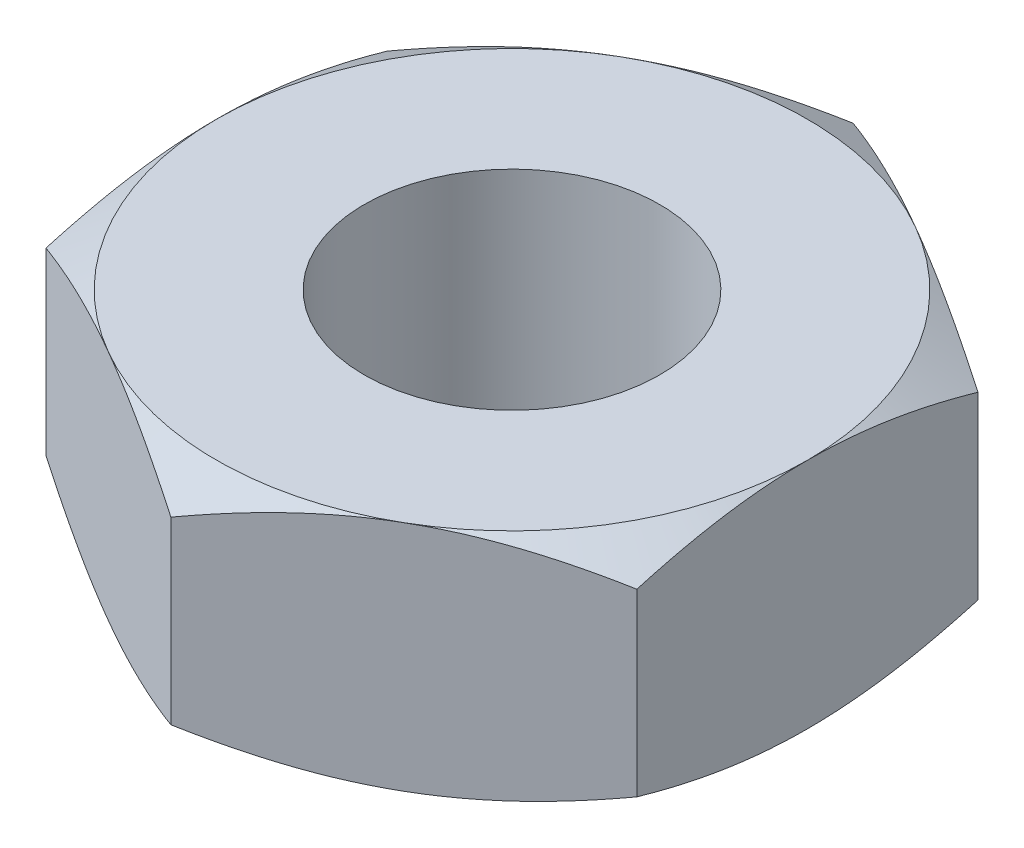
from build123d import *

# Parameters (mm, degrees)
BOSS_EXTRUDE2_DEPTH     = 5
SKETCH6_R               = 6.35
CUT_EXTRUDE3_DEPTH      = 22.82529114
SKETCH7_OUTSIDE_W       = 114.482
SKETCH7_OUTSIDE_H       = 118.412
SKETCH7_OUTSIDE_R       = 12.7
CUT_EXTRUDE4_DEPTH      = 22.82529114
CUT_EXTRUDE4_DRAFT      = -60
MIRROR3_COPY_1_SKETCH_W = 114.482
MIRROR3_COPY_1_SKETCH_H = 118.412
MIRROR3_COPY_1_SKETCH_R = 12.7
MIRROR3_COPY_1_DEPTH    = 22.82529114
MIRROR3_COPY_1_DRAFT    = -60


with BuildPart() as part:
    # Sketch2 → Boss-Extrude2 (new, symmetric)
    with BuildSketch(Plane(origin=(0, 0, 0), x_dir=(1, 0, 0), z_dir=(0, 1, 0))):
        Polygon((0, -14.664696837), (12.7, -7.332348419), (12.7, 7.332348419), (0, 14.664696837), (-12.7, 7.332348419), (-12.7, -7.332348419), align=None)
    extrude(amount=BOSS_EXTRUDE2_DEPTH, both=True)

    # Sketch6 → Cut-Extrude3 (cut, through all)
    with BuildSketch(Plane(origin=(0, 5, 0), x_dir=(1, 0, 0), z_dir=(0, 1, 0))):
        with Locations(Location((0, 0, 0), (0, 0, 270))):
            Circle(SKETCH6_R)
    extrude(amount=-CUT_EXTRUDE3_DEPTH, mode=Mode.SUBTRACT)


with BuildPart() as cut_extrude4_tool:
    # Sketch7 outside → Cut-Extrude4 (with draft: the straight prism first)
    with BuildSketch(Plane(origin=(0, 5, 0), x_dir=(1, 0, 0), z_dir=(0, 1, 0))):
        Rectangle(SKETCH7_OUTSIDE_W, SKETCH7_OUTSIDE_H)
        Circle(SKETCH7_OUTSIDE_R, mode=Mode.SUBTRACT)
    extrude(amount=-CUT_EXTRUDE4_DEPTH)
    # Cut-Extrude4: the draft: its side faces are tilted about the plane it starts from
    cut_extrude4_sides = [cut_extrude4_tool.faces().sort_by_distance(p)[0] for p in [
        (0, -6.41264557, 59.206),
        (57.241, -6.41264557, 0),
        (0, -6.41264557, -59.206),
        (-57.241, -6.41264557, 0),
        (-12.7, -6.41264557, 0),
    ]]
    draft(cut_extrude4_sides, Plane(origin=(0, 5, 0), x_dir=(1, 0, 0), z_dir=(0, 1, 0)), CUT_EXTRUDE4_DRAFT)


with BuildPart() as part_1:
    add(part.part)

    # Cut-Extrude4: cut by cut_extrude4_tool
    add(cut_extrude4_tool.part, mode=Mode.SUBTRACT)


with BuildPart() as mirror3_copy_1_tool:
    # Mirror3 copy 1 sketch → Mirror3 copy 1 (with draft: the straight prism first)
    with BuildSketch(Plane.XZ.offset(5)):
        Rectangle(MIRROR3_COPY_1_SKETCH_W, MIRROR3_COPY_1_SKETCH_H)
        Circle(MIRROR3_COPY_1_SKETCH_R, mode=Mode.SUBTRACT)
    extrude(amount=-MIRROR3_COPY_1_DEPTH)
    # Mirror3 copy 1: the draft: its side faces are tilted about the plane it starts from
    mirror3_copy_1_sides = [mirror3_copy_1_tool.faces().sort_by_distance(p)[0] for p in [
        (0, 6.41264557, 59.206),
        (57.241, 6.41264557, 0),
        (0, 6.41264557, -59.206),
        (-57.241, 6.41264557, 0),
        (-12.7, 6.41264557, 0),
    ]]
    draft(mirror3_copy_1_sides, Plane.XZ.offset(5), MIRROR3_COPY_1_DRAFT)


with BuildPart() as part_2:
    add(part_1.part)

    # Mirror3 copy 1: cut by mirror3_copy_1_tool
    add(mirror3_copy_1_tool.part, mode=Mode.SUBTRACT)


solid = part_2.part
